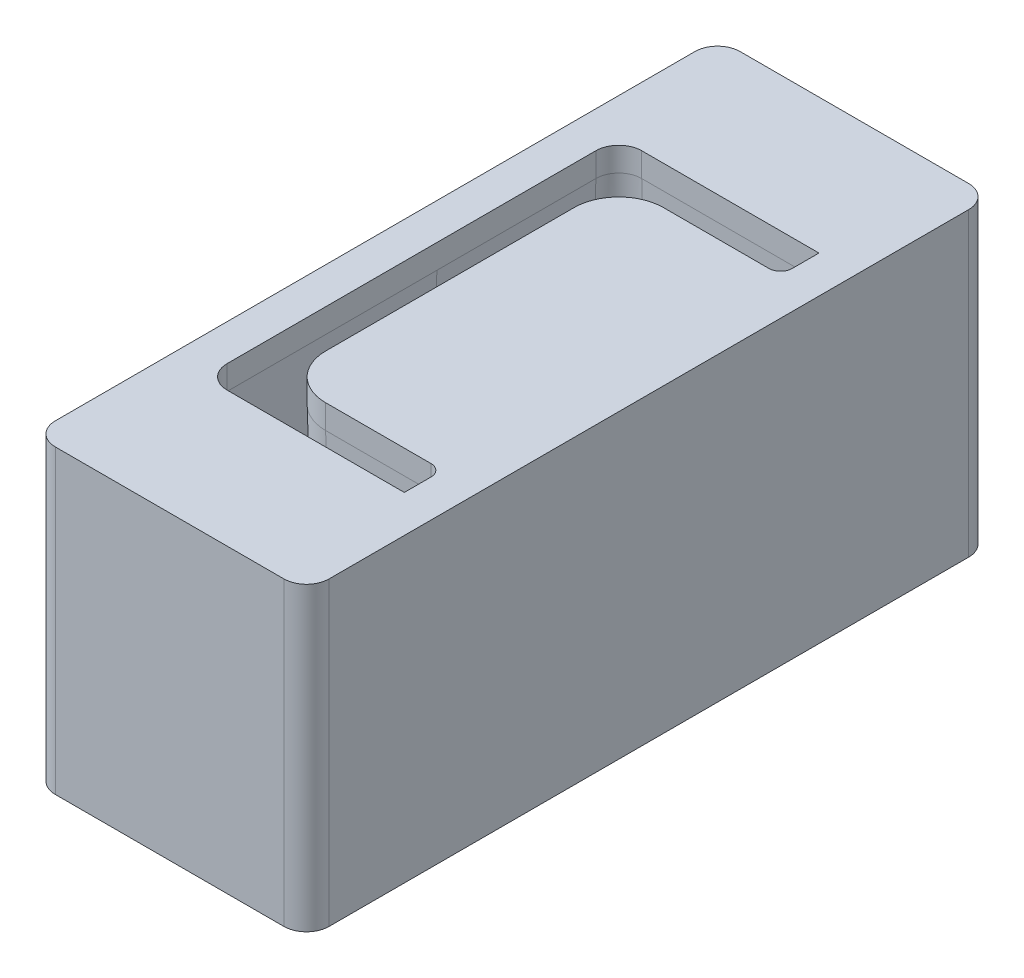
from build123d import *

# Parameters (mm, degrees)
SKETCH1_W             = 36.38
SKETCH1_H             = 91
BOSS_EXTRUDE1_DEPTH   = 40
FILLET1_R             = 3
CUT_EXTRUDE1_REACH    = 73.432
M8_TAPPED_HOLE1_D     = 6.8
M8_TAPPED_HOLE1_DEPTH = 22.25
M8_TAPPED_HOLE1_TIP   = 2.042926105


with BuildPart() as part:
    # Sketch1 → Boss-Extrude1 (new body)
    with BuildSketch(Plane(origin=(0, 0, 0), x_dir=(1, 0, 0), z_dir=(0, 1, 0))):
        with Locations((15.19, -3.37)):
            Rectangle(SKETCH1_W, SKETCH1_H)
    extrude(amount=-BOSS_EXTRUDE1_DEPTH)

    # Fillet1
    fillet1_edges = [part.edges().sort_by_distance(p)[0] for p in [
        (33.38, -20, 48.87),
        (-3, -20, 48.87),
        (-3, -20, -42.13),
        (33.38, -20, -42.13),
    ]]
    fillet(fillet1_edges, radius=FILLET1_R)

    # Sketch2 → Cut-Extrude1 (cut, up to next)
    with BuildSketch(Plane(origin=(0, 0, 0), x_dir=(1, 0, 0), z_dir=(0, 1, 0)), mode=Mode.PRIVATE) as cut_extrude1_sk1:
        with BuildLine():
            Line((28.43, 24.18), (4.88, 24.18))
            ThreePointArc((4.88, 24.18), (2.723324317, 23.286675683), (1.83, 21.13))
            Line((1.83, 21.13), (1.83, -27.87))
            ThreePointArc((1.83, -27.87), (2.723324317, -30.026675683), (4.88, -30.92))
            Line((4.88, -30.92), (28.43, -30.92))
            Line((28.43, -30.92), (28.43, -27.37))
            ThreePointArc((28.43, -27.37), (27.976015511, -26.273984489), (26.88, -25.82))
            Line((26.88, -25.82), (12.88, -25.82))
            ThreePointArc((12.88, -25.82), (8.672714652, -24.077285348), (6.93, -19.87))
            Line((6.93, -19.87), (6.93, 13.13))
            ThreePointArc((6.93, 13.13), (8.672714652, 17.337285348), (12.88, 19.08))
            Line((12.88, 19.08), (26.88, 19.08))
            ThreePointArc((26.88, 19.08), (27.976015511, 19.533984489), (28.43, 20.63))
            Line((28.43, 20.63), (28.43, 24.18))
        make_face()
    cut_extrude1_tool1 = extrude(cut_extrude1_sk1.sketch, amount=-CUT_EXTRUDE1_REACH, mode=Mode.PRIVATE) & part.part
    add(cut_extrude1_tool1.solids().sort_by_distance((6.318153, 0, 3.37))[0], mode=Mode.SUBTRACT)

    # Cut-Sweep1: sweep along a path in Sketch4
    with BuildLine(Plane(origin=(0, 0, 0), x_dir=(1, 0, 0), z_dir=(0, 1, 0))) as cut_sweep1_path:
        Line((28.43, 20.63), (28.43, 24.18))
        Line((28.43, 24.18), (4.88, 24.18))
        ThreePointArc((4.88, 24.18), (2.723324317, 23.286675683), (1.83, 21.13))
        Line((1.83, 21.13), (1.83, -27.87))
        ThreePointArc((1.83, -27.87), (2.723324317, -30.026675683), (4.88, -30.92))
        Line((4.88, -30.92), (28.43, -30.92))
        Line((28.43, -30.92), (28.43, -27.37))
        ThreePointArc((28.43, -27.37), (27.976015511, -26.273984489), (26.88, -25.82))
        Line((26.88, -25.82), (12.88, -25.82))
        ThreePointArc((12.88, -25.82), (8.672714652, -24.077285348), (6.93, -19.87))
        Line((6.93, -19.87), (6.93, 13.13))
        ThreePointArc((6.93, 13.13), (8.672714652, 17.337285348), (12.88, 19.08))
        Line((12.88, 19.08), (26.88, 19.08))
        ThreePointArc((26.88, 19.08), (27.976015511, 19.533984489), (28.43, 20.63))
    # Sketch3 → Cut-Sweep1 (sweep, cut)
    with BuildSketch(Plane.XY):
        Polygon((1.83, -3.2), (1.187653611, -40), (1.83, -40), align=None)
    sweep(path=cut_sweep1_path.line, transition=Transition.RIGHT, mode=Mode.SUBTRACT)

    # M8 Tapped Hole1
    with Locations(Plane(origin=(0, -40, 0), x_dir=(-1, 0, 0), z_dir=(0, -1, 0))):
        with Locations((-15.19, 33.476173195), (-15.19, -40.216173195)):
            Hole(M8_TAPPED_HOLE1_D / 2, depth=M8_TAPPED_HOLE1_DEPTH)
            with Locations((0, 0, -(M8_TAPPED_HOLE1_DEPTH + M8_TAPPED_HOLE1_TIP / 2))):  # 118° drill point
                Cone(0, M8_TAPPED_HOLE1_D / 2, M8_TAPPED_HOLE1_TIP, mode=Mode.SUBTRACT)


solid = part.part
